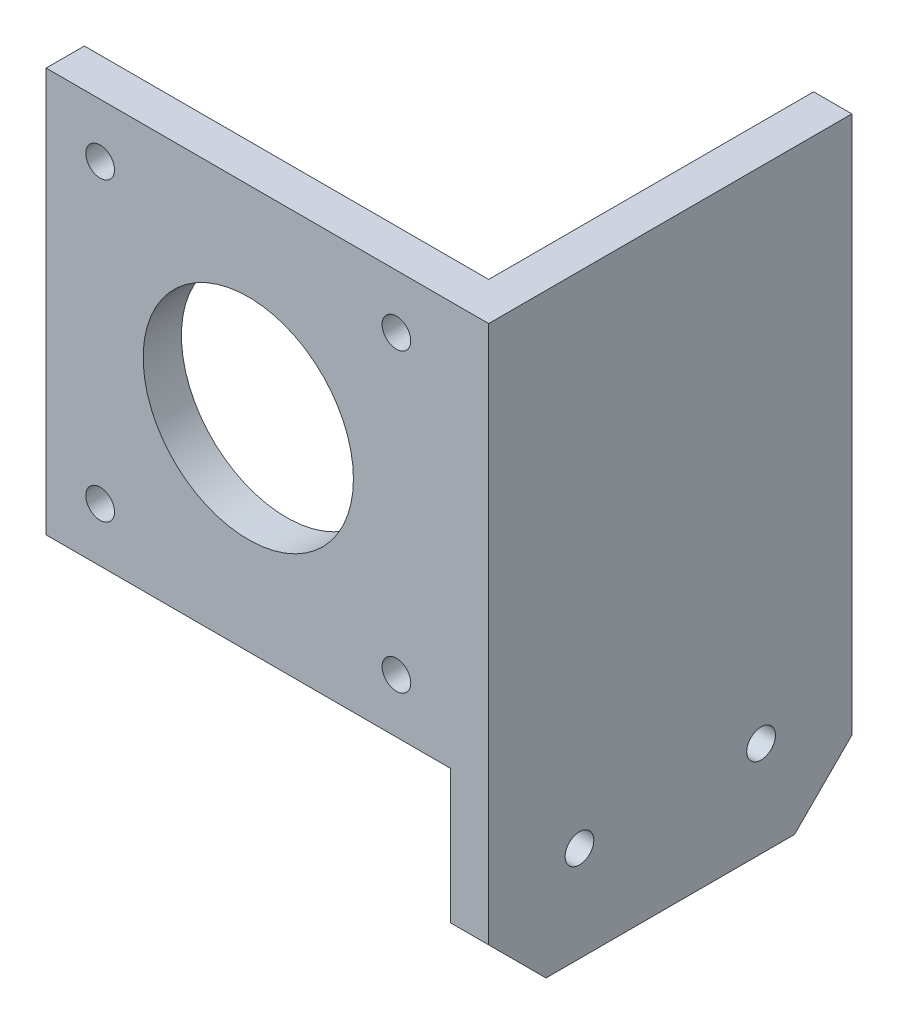
from build123d import *

# Parameters (mm, degrees)
SKETCH_1_W      = 42.3
SKETCH_1_H      = 42.3
SKETCH_1_R      = 11
SKETCH_1_R_2    = 1.5
EXTRUDE_1_DEPTH = 4
SKETCH_2_W      = 38
SKETCH_2_H      = 62.3
SKETCH_2_R      = 1.5
EXTRUDE_2_DEPTH = 4
CHAMFER_1_SIZE  = 6


with BuildPart() as part:
    # 스케치1 → 보스-돌출1 (new body)
    with BuildSketch(Plane.XY):
        Rectangle(SKETCH_1_W, SKETCH_1_H)
        Circle(SKETCH_1_R, mode=Mode.SUBTRACT)
        with Locations((-15.5, 15.5)):
            Circle(SKETCH_1_R_2, mode=Mode.SUBTRACT)
        with Locations(Location((15.5, 15.5, 0), (0, 0, 180))):
            Circle(SKETCH_1_R_2, mode=Mode.SUBTRACT)
        with Locations((15.5, -15.5)):
            Circle(SKETCH_1_R_2, mode=Mode.SUBTRACT)
        with Locations(Location((-15.5, -15.5, 0), (0, 0, 180))):
            Circle(SKETCH_1_R_2, mode=Mode.SUBTRACT)
    extrude(amount=EXTRUDE_1_DEPTH)

    # 스케치2 → 보스-돌출2 (add)
    with BuildSketch(Plane(origin=(21.15, 0, 0), x_dir=(0, 0, -1), z_dir=(1, 0, 0))):
        with Locations((15, -10)):
            Rectangle(SKETCH_2_W, SKETCH_2_H)
        with Locations((5.5, -31.15)):
            Circle(SKETCH_2_R, mode=Mode.SUBTRACT)
        with Locations(Location((24.5, -31.15, 0), (0, 0, 180))):
            Circle(SKETCH_2_R, mode=Mode.SUBTRACT)
    extrude(amount=EXTRUDE_2_DEPTH)

    # 모따기1
    chamfer_1_edges = [part.edges().sort_by_distance(p)[0] for p in [
        (23.15, -41.15, 4),
        (23.15, -41.15, -34),
    ]]
    chamfer(chamfer_1_edges, length=CHAMFER_1_SIZE)


solid = part.part
